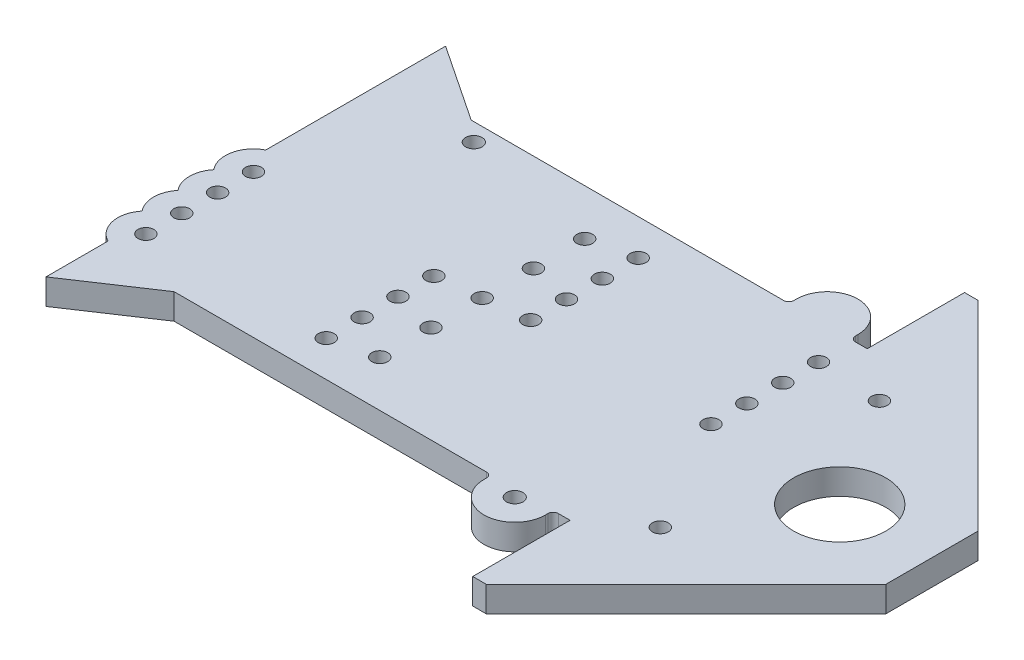
from build123d import *

# Parameters (mm, degrees)
SKETCH1_R           = 1.55
SKETCH1_R_2         = 9
SKETCH1_R_3         = 1.605
BOSS_EXTRUDE1_DEPTH = 5
SKETCH3_R           = 3.05
CUT_EXTRUDE1_DEPTH  = 2


with BuildPart() as part:
    # Sketch1 → Boss-Extrude1 (new body)
    with BuildSketch(Plane(origin=(0, 0, 0), x_dir=(1, 0, 0), z_dir=(0, 1, 0))):
        with BuildLine():
            Line((28.57509878, 48.821516158), (28.57509878, 67.821516158))
            Line((28.57509878, 67.821516158), (31.202515778, 67.821516158))
            Line((31.202515778, 67.821516158), (70.213351221, 28.810680715))
            Line((70.213351221, 28.810680715), (70.213351221, 10.832351601))
            Line((70.213351221, 10.832351601), (31.202515778, -28.178483842))
            Line((31.202515778, -28.178483842), (28.57509878, -28.178483842))
            Line((28.57509878, -28.178483842), (28.57509878, -9.178483842))
            Line((28.57509878, -9.178483842), (26.27009878, -9.178483842))
            ThreePointArc((26.27009878, -9.178483842), (25.562991999, -9.471377061), (25.27009878, -10.178483842))
            Line((25.27009878, -10.178483842), (25.27009878, -10.673483842))
            ThreePointArc((25.27009878, -10.673483842), (19.27009878, -16.673483842), (13.27009878, -10.673483842))
            Line((13.27009878, -10.673483842), (13.27009878, -10.178483842))
            ThreePointArc((13.27009878, -10.178483842), (12.977205561, -9.471377061), (12.27009878, -9.178483842))
            Line((12.27009878, -9.178483842), (-48.72490122, -9.178483842))
            Line((-48.72490122, -9.178483842), (-63.72490122, -19.178483842))
            Line((-63.72490122, -19.178483842), (-63.72490122, -9.178483842))
            Line((-63.72490122, -9.178483842), (-63.72490122, -7.077463327))
            ThreePointArc((-63.72490122, -7.077463327), (-66.610206686, -3.295840115), (-65.467541907, 1.321516158))
            ThreePointArc((-65.467541907, 1.321516158), (-66.72490122, 4.821516158), (-65.467541907, 8.321516158))
            ThreePointArc((-65.467541907, 8.321516158), (-66.72490122, 11.821516158), (-65.467541907, 15.321516158))
            ThreePointArc((-65.467541907, 15.321516158), (-66.610206686, 19.938872432), (-63.72490122, 23.720495644))
            Line((-63.72490122, 23.720495644), (-63.72490122, 48.821516158))
            Line((-63.72490122, 48.821516158), (-63.72490122, 58.821516158))
            Line((-63.72490122, 58.821516158), (-48.72490122, 48.821516158))
            Line((-48.72490122, 48.821516158), (12.27009878, 48.821516158))
            ThreePointArc((12.27009878, 48.821516158), (12.977205561, 49.114409377), (13.27009878, 49.821516158))
            Line((13.27009878, 49.821516158), (13.27009878, 50.316516158))
            ThreePointArc((13.27009878, 50.316516158), (19.27009878, 56.316516158), (25.27009878, 50.316516158))
            Line((25.27009878, 50.316516158), (25.27009878, 49.821516158))
            ThreePointArc((25.27009878, 49.821516158), (25.562991999, 49.114409377), (26.27009878, 48.821516158))
            Line((26.27009878, 48.821516158), (28.57509878, 48.821516158))
        make_face()
        with Locations(Location((26.07509878, 20.821516158, 0), (0, 0, 270))):
            Circle(SKETCH1_R, mode=Mode.SUBTRACT)
        with Locations(Location((-9.12490122, 20.821516158, 0), (0, 0, 270))):
            Circle(SKETCH1_R, mode=Mode.SUBTRACT)
        with Locations(Location((-9.12490122, 27.821516158, 0), (0, 0, 270))):
            Circle(SKETCH1_R, mode=Mode.SUBTRACT)
        with Locations(Location((26.07509878, 27.821516158, 0), (0, 0, 270))):
            Circle(SKETCH1_R, mode=Mode.SUBTRACT)
        with Locations(Location((-9.12490122, 34.821516158, 0), (0, 0, 270))):
            Circle(SKETCH1_R, mode=Mode.SUBTRACT)
        with Locations(Location((26.07509878, 34.821516158, 0), (0, 0, 270))):
            Circle(SKETCH1_R, mode=Mode.SUBTRACT)
        with Locations(Location((-9.12490122, 41.821516158, 0), (0, 0, 270))):
            Circle(SKETCH1_R, mode=Mode.SUBTRACT)
        with Locations(Location((26.07509878, 41.821516158, 0), (0, 0, 270))):
            Circle(SKETCH1_R, mode=Mode.SUBTRACT)
        with Locations(Location((-26.02490122, -2.178483842, 0), (0, 0, 270))):
            Circle(SKETCH1_R, mode=Mode.SUBTRACT)
        with Locations(Location((-61.22490122, -2.178483842, 0), (0, 0, 270))):
            Circle(SKETCH1_R, mode=Mode.SUBTRACT)
        with Locations(Location((-26.02490122, 4.821516158, 0), (0, 0, 270))):
            Circle(SKETCH1_R, mode=Mode.SUBTRACT)
        with Locations(Location((-61.22490122, 4.821516158, 0), (0, 0, 270))):
            Circle(SKETCH1_R, mode=Mode.SUBTRACT)
        with Locations(Location((-26.02490122, 11.821516158, 0), (0, 0, 270))):
            Circle(SKETCH1_R, mode=Mode.SUBTRACT)
        with Locations(Location((-61.22490122, 11.821516158, 0), (0, 0, 270))):
            Circle(SKETCH1_R, mode=Mode.SUBTRACT)
        with Locations(Location((-26.02490122, 18.821516158, 0), (0, 0, 270))):
            Circle(SKETCH1_R, mode=Mode.SUBTRACT)
        with Locations(Location((-61.22490122, 18.821516158, 0), (0, 0, 270))):
            Circle(SKETCH1_R, mode=Mode.SUBTRACT)
        with Locations(Location((-17.57490122, 39.821516158, 0), (0, 0, 270))):
            Circle(SKETCH1_R, mode=Mode.SUBTRACT)
        with Locations(Location((-17.57490122, 29.821516158, 0), (0, 0, 270))):
            Circle(SKETCH1_R, mode=Mode.SUBTRACT)
        with Locations(Location((-17.57490122, 19.821516158, 0), (0, 0, 270))):
            Circle(SKETCH1_R, mode=Mode.SUBTRACT)
        with Locations(Location((-17.57490122, 9.821516158, 0), (0, 0, 270))):
            Circle(SKETCH1_R, mode=Mode.SUBTRACT)
        with Locations(Location((-17.57490122, -0.178483842, 0), (0, 0, 270))):
            Circle(SKETCH1_R, mode=Mode.SUBTRACT)
        with Locations(Location((52.213351221, 19.821516158, 0), (0, 0, 270))):
            Circle(SKETCH1_R_2, mode=Mode.SUBTRACT)
        with Locations(Location((19.27009878, -10.673483842, 0), (0, 0, 270))):
            Circle(SKETCH1_R_3, mode=Mode.SUBTRACT)
        with Locations(Location((-44.73990122, 45.346516158, 0), (0, 0, 270))):
            Circle(SKETCH1_R_3, mode=Mode.SUBTRACT)
        with Locations(Location((38.57509878, 41.206292469, 0), (0, 0, 270))):
            Circle(SKETCH1_R, mode=Mode.SUBTRACT)
        with Locations(Location((38.57509878, -1.563260153, 0), (0, 0, 270))):
            Circle(SKETCH1_R, mode=Mode.SUBTRACT)
    extrude(amount=BOSS_EXTRUDE1_DEPTH)

    # Sketch3 → Cut-Extrude1 (cut)
    with BuildSketch(Plane(origin=(0, 0, 0), x_dir=(-1, 0, 0), z_dir=(0, -1, 0))):
        with Locations(Location((61.22490122, -2.178483842, 0), (0, 0, 90))):
            Circle(SKETCH3_R)
        with Locations(Location((61.22490122, 4.821516158, 0), (0, 0, 90))):
            Circle(SKETCH3_R)
        with Locations(Location((61.22490122, 11.821516158, 0), (0, 0, 90))):
            Circle(SKETCH3_R)
        with Locations(Location((61.22490122, 18.821516158, 0), (0, 0, 90))):
            Circle(SKETCH3_R)
        with Locations(Location((26.02490122, -2.178483842, 0), (0, 0, 90))):
            Circle(SKETCH3_R)
        with Locations(Location((26.02490122, 4.821516158, 0), (0, 0, 90))):
            Circle(SKETCH3_R)
        with Locations(Location((26.02490122, 11.821516158, 0), (0, 0, 90))):
            Circle(SKETCH3_R)
        with Locations(Location((26.02490122, 18.821516158, 0), (0, 0, 90))):
            Circle(SKETCH3_R)
        with Locations(Location((17.57490122, -0.178483842, 0), (0, 0, 90))):
            Circle(SKETCH3_R)
        with Locations(Location((17.57490122, 9.821516158, 0), (0, 0, 90))):
            Circle(SKETCH3_R)
        with Locations(Location((17.57490122, 19.821516158, 0), (0, 0, 90))):
            Circle(SKETCH3_R)
        with Locations(Location((17.57490122, 29.821516158, 0), (0, 0, 90))):
            Circle(SKETCH3_R)
        with Locations(Location((17.57490122, 39.821516158, 0), (0, 0, 90))):
            Circle(SKETCH3_R)
        with Locations(Location((9.12490122, 20.821516158, 0), (0, 0, 90))):
            Circle(SKETCH3_R)
        with Locations(Location((9.12490122, 27.821516158, 0), (0, 0, 90))):
            Circle(SKETCH3_R)
        with Locations(Location((9.12490122, 34.821516158, 0), (0, 0, 90))):
            Circle(SKETCH3_R)
        with Locations(Location((9.12490122, 41.821516158, 0), (0, 0, 90))):
            Circle(SKETCH3_R)
        with Locations(Location((-26.07509878, 20.821516158, 0), (0, 0, 90))):
            Circle(SKETCH3_R)
        with Locations(Location((-26.07509878, 27.821516158, 0), (0, 0, 90))):
            Circle(SKETCH3_R)
        with Locations(Location((-26.07509878, 34.821516158, 0), (0, 0, 90))):
            Circle(SKETCH3_R)
        with Locations(Location((-26.07509878, 41.821516158, 0), (0, 0, 90))):
            Circle(SKETCH3_R)
        with Locations(Location((-19.27009878, -10.673483842, 0), (0, 0, 90))):
            Circle(SKETCH3_R)
        with Locations(Location((44.73990122, 45.346516158, 0), (0, 0, 90))):
            Circle(SKETCH3_R)
        with Locations(Location((-38.57509878, 41.206292469, 0), (0, 0, 90))):
            Circle(SKETCH3_R)
        with Locations(Location((-38.57509878, -1.563260153, 0), (0, 0, 90))):
            Circle(SKETCH3_R)
    extrude(amount=-CUT_EXTRUDE1_DEPTH, mode=Mode.SUBTRACT)


solid = part.part
